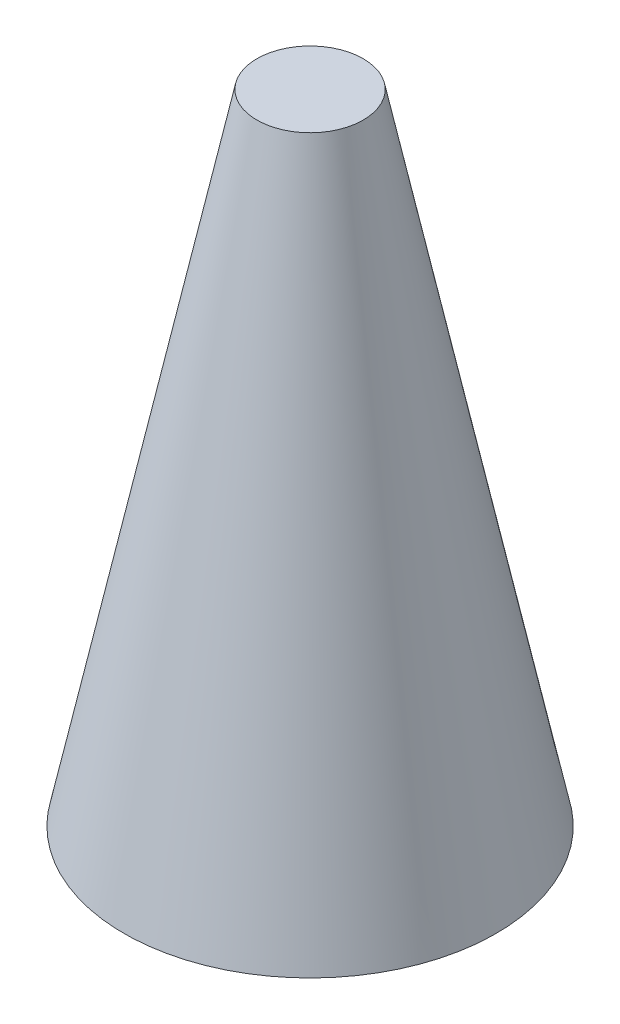
from build123d import *

# Parameters (mm, degrees)
SKETCH1_R          = 44.45
SKETCH2_R          = 12.7
SKETCH3_W          = 12.7
SKETCH3_H          = 2.27948718
CUT_EXTRUDE1_DEPTH = 0.635


with BuildPart() as part:
    # Sketch1 → Loft1 section 0
    with BuildSketch(Plane(origin=(0, 0, 0), x_dir=(1, 0, 0), z_dir=(0, 1, 0))):
        Circle(SKETCH1_R)
    # Sketch2 → Loft1 section 1
    with BuildSketch(Plane(origin=(0, 152.4, 0), x_dir=(1, 0, 0), z_dir=(0, 1, 0))):
        Circle(SKETCH2_R)
    loft()

    # Sketch3 → Cut-Extrude1 (cut, symmetric)
    # profile 1 of 8: a face of its own
    with BuildSketch(Plane.XY):
        Polygon((-12.7, 40.159604159), (-12.7, 42.273726755), (0, 47.402572909), (0, 44.967897428), (-2.605128205, 43.980798069), (-2.605128205, 38.447444704), (0, 37.460345345), (0, 35.028213935), align=None)
        Polygon((-9.293489583, 41.215393422), (-4.884615385, 39.312428678), (-4.884615385, 43.118358166), align=None, mode=Mode.SUBTRACT)
    # profile 2 of 8: a face of its own
    with BuildSketch(Plane.XY):
        Polygon((-12.7, 48.216675473), (-12.7, 50.651350954), (-3.678725962, 53.915393422), (-12.7, 57.187068102), (-12.7, 59.614111371), (0, 55.009343743), (0, 52.81381089), align=None)
    # profile 3 of 8: a face of its own
    with BuildSketch(Plane.XY):
        with Locations((-6.35, 62.463470345)):
            Rectangle(SKETCH3_W, SKETCH3_H)
    # profile 4 of 8: a face of its own
    with BuildSketch(Plane.XY):
        with BuildLine():
            add(Edge.make_bspline(
                [(-13.025641026, 72.502372589), (-13.019922875, 72.723176969), (-13.00863395, 73.159094828), (-12.914566289, 73.800184538), (-12.761211056, 74.417947016), (-12.548338685, 75.012321034), (-12.269051032, 75.580606207), (-11.936154491, 76.128341193), (-11.53517916, 76.648588623), (-11.080406068, 77.139551134), (-10.585538235, 77.593145033), (-10.052743409, 77.986084123), (-9.495390953, 78.322086503), (-8.911368625, 78.598511224), (-8.298685283, 78.810842923), (-7.659894011, 78.95919305), (-6.994821801, 79.054622362), (-6.541984355, 79.065589055), (-6.311838942, 79.071162653)],
                knots=[0, 0, 0, 0, 1.014235534, 2.002330665, 2.970116157, 3.9352621, 4.897279957, 5.875024536, 6.875755618, 7.909865842, 8.947091691, 9.955591861, 10.946663836, 11.933282567, 12.91916997, 13.920121047, 14.942943865, 16, 16, 16, 16], degree=3))
            add(Edge.make_bspline(
                [(-6.311838942, 79.071162653), (-6.084287447, 79.065225084), (-5.635889924, 79.053524915), (-4.976936454, 78.963107348), (-4.345025285, 78.812164139), (-3.738871989, 78.604011862), (-3.161533094, 78.332117676), (-2.6105987, 78.001863993), (-2.087958308, 77.609771832), (-1.595814177, 77.165235751), (-1.146050215, 76.678870136), (-0.75228548, 76.160850281), (-0.418701657, 75.617349717), (-0.143997915, 75.048794109), (0.063225645, 74.451086429), (0.218184545, 73.830973575), (0.30782395, 73.183411934), (0.319642272, 72.743481406), (0.325641026, 72.520181082)],
                knots=[0, 0, 0, 0, 1.051628416, 2.072267533, 3.067761847, 4.050852917, 5.029392597, 6.012272624, 7.015026456, 8.044749159, 9.073964344, 10.072810436, 11.047668484, 12.017263184, 12.98554948, 13.966731695, 14.967951888, 16, 16, 16, 16], degree=3))
            add(Edge.make_bspline(
                [(0.325641026, 72.520181082), (0.320322268, 72.28661812), (0.309871637, 71.827698824), (0.211329257, 71.155901664), (0.061088275, 70.51317926), (-0.156424517, 69.901292689), (-0.439052106, 69.320717622), (-0.780303352, 68.768850427), (-1.18676999, 68.249841636), (-1.646192299, 67.765421258), (-2.149031439, 67.326586345), (-2.680202567, 66.939215095), (-3.235688751, 66.612462207), (-3.815739357, 66.346310897), (-4.416752283, 66.136488115), (-5.042387137, 65.988481928), (-5.691143615, 65.901051154), (-6.131791977, 65.888872554), (-6.355088141, 65.882701114)],
                knots=[0, 0, 0, 0, 1.067953136, 2.098381936, 3.099641766, 4.083805132, 5.062469929, 6.048665414, 7.046702845, 8.073106546, 9.098695993, 10.09591865, 11.076726721, 12.041940862, 13.011263376, 13.984305721, 14.978557872, 16, 16, 16, 16], degree=3))
            add(Edge.make_bspline(
                [(-6.355088141, 65.882701114), (-6.505309894, 65.884638634), (-6.803851249, 65.88848914), (-7.246278119, 65.934850657), (-7.680054443, 66.001640845), (-8.103521218, 66.100260555), (-8.520167168, 66.220841461), (-8.926280439, 66.375024827), (-9.32461512, 66.55278815), (-9.710706686, 66.758316324), (-10.080107953, 66.990666806), (-10.435994612, 67.238793262), (-10.769052871, 67.512143635), (-11.082834981, 67.805131503), (-11.376139006, 68.118736218), (-11.648660059, 68.453589992), (-11.903517102, 68.807287645), (-12.137326798, 69.179861702), (-12.344000904, 69.568556452), (-12.529078651, 69.964794671), (-12.681011025, 70.370222964), (-12.80610225, 70.782465347), (-12.906628231, 71.200939202), (-12.973437772, 71.628970631), (-13.019780845, 72.06292166), (-13.023682996, 72.355541311), (-13.025641026, 72.502372589)],
                knots=[0, 0, 0, 0, 1.034634222, 2.056167603, 3.061938024, 4.056975325, 5.049831446, 6.048294015, 7.047371884, 8.053753139, 9.058980286, 10.052730068, 11.041053953, 12.024946181, 13.008838409, 13.997162294, 14.997691456, 16.01096975, 17.025258359, 18.029177048, 19.022170708, 20.005507574, 20.996177714, 21.984639769, 22.988728483, 24, 24, 24, 24], degree=3))
        make_face()
        with BuildLine():
            add(Edge.make_bspline(
                [(-10.746153846, 72.466755602), (-10.742166527, 72.318153822), (-10.734297154, 72.024873375), (-10.674343176, 71.59468437), (-10.578589859, 71.181687733), (-10.439892349, 70.788172867), (-10.26336562, 70.412434246), (-10.049626478, 70.053805801), (-9.79132788, 69.717253794), (-9.502336724, 69.39829063), (-9.180334163, 69.110159897), (-8.835253657, 68.855587305), (-8.467671483, 68.642551049), (-8.081002395, 68.46413185), (-7.6708984, 68.329821736), (-7.240571887, 68.234156669), (-6.789281382, 68.173699918), (-6.481637233, 68.166079269), (-6.324559295, 68.162188294)],
                knots=[0, 0, 0, 0, 1.033739768, 2.040188636, 3.016340934, 3.979330865, 4.937572243, 5.900995986, 6.878200029, 7.884839167, 8.891893314, 9.879764717, 10.863503415, 11.843163062, 12.837761627, 13.859916423, 14.907309254, 16, 16, 16, 16], degree=3))
            add(Edge.make_bspline(
                [(-6.324559295, 68.162188294), (-6.150486635, 68.16735897), (-5.809333063, 68.177492638), (-5.31158233, 68.248464697), (-4.841062105, 68.370973396), (-4.400108624, 68.544706786), (-3.986238415, 68.764896826), (-3.60178374, 69.034598762), (-3.244936614, 69.353769018), (-3.036539708, 69.59951887), (-2.930769231, 69.724247589)],
                knots=[0, 0, 0, 0, 1.078420897, 2.113526272, 3.107597235, 4.084297302, 5.043369457, 6.005430726, 6.9876695, 8, 8, 8, 8], degree=3))
            add(Edge.make_bspline(
                [(-2.930769231, 69.724247589), (-2.85263397, 69.826432799), (-2.698123851, 70.028500971), (-2.500087435, 70.351045765), (-2.330350472, 70.683203392), (-2.193205013, 71.027480396), (-2.085328701, 71.383149683), (-2.009784693, 71.750162478), (-1.962374295, 72.127998757), (-1.956707854, 72.383509356), (-1.953846154, 72.512548871)],
                knots=[0, 0, 0, 0, 1.023928204, 2.024787132, 3.009472467, 3.9914905, 4.972207045, 5.96565515, 6.972602802, 8, 8, 8, 8], degree=3))
            add(Edge.make_bspline(
                [(-1.953846154, 72.512548871), (-1.957873199, 72.658592448), (-1.965796538, 72.945937779), (-2.024927941, 73.368161292), (-2.125453519, 73.772466216), (-2.261908449, 74.162649338), (-2.444987196, 74.533302532), (-2.661276648, 74.890322206), (-2.921252371, 75.227484388), (-3.216332822, 75.544666), (-3.539466929, 75.835594999), (-3.884660788, 76.092249325), (-4.248702457, 76.308790041), (-4.631531715, 76.485848729), (-5.03272783, 76.624544245), (-5.453519807, 76.719241337), (-5.89199049, 76.780158945), (-6.19036471, 76.787788626), (-6.342367788, 76.791675473)],
                knots=[0, 0, 0, 0, 1.026460056, 2.019592442, 2.989754624, 3.951362471, 4.919177453, 5.890456226, 6.881277895, 7.906300149, 8.932084862, 9.933608786, 10.925308803, 11.904168404, 12.893913482, 13.903284022, 14.931853825, 16, 16, 16, 16], degree=3))
            add(Edge.make_bspline(
                [(-6.342367788, 76.791675473), (-6.493502337, 76.787667956), (-6.790987646, 76.77977977), (-7.22825203, 76.720314012), (-7.646694952, 76.621454212), (-8.047395052, 76.481733719), (-8.432455975, 76.307671058), (-8.798535724, 76.089019378), (-9.145317573, 75.830518063), (-9.470739862, 75.536892736), (-9.769802147, 75.217352183), (-10.02932874, 74.874279614), (-10.254850424, 74.517290996), (-10.431514685, 74.138190974), (-10.572262812, 73.744736731), (-10.675911731, 73.33452709), (-10.733875975, 72.906008439), (-10.742024742, 72.614478337), (-10.746153846, 72.466755602)],
                knots=[0, 0, 0, 0, 1.055040155, 2.076685641, 3.074845078, 4.052329834, 5.035358467, 6.020382375, 7.023447318, 8.050688466, 9.077178457, 10.074336316, 11.0503314, 12.019748348, 12.988025369, 13.964577102, 14.968620271, 16, 16, 16, 16], degree=3))
        make_face(mode=Mode.SUBTRACT)
    # profile 5 of 8: a face of its own
    with BuildSketch(Plane.XY):
        Polygon((-12.7, 81.350649832), (-12.7, 83.403714736), (-4.342728365, 89.166034448), (-12.7, 89.166034448), (-12.7, 91.445521627), (0, 91.445521627), (0, 89.3771923), (-8.331830929, 83.630137012), (0, 83.630137012), (0, 81.350649832), align=None)
    # profile 6 of 8: a face of its own
    with BuildSketch(Plane.XY):
        with Locations((-6.35, 95.190393422)):
            Rectangle(SKETCH3_W, SKETCH3_H)
    # profile 7 of 8: a face of its own
    with BuildSketch(Plane.XY):
        with BuildLine():
            Line((-10.496834936, 110.65834214), (-8.899158654, 108.986887813))
            add(Edge.make_bspline(
                [(-8.899158654, 108.986887813), (-9.045791405, 108.845114645), (-9.332211107, 108.568187233), (-9.710986026, 108.121727467), (-10.027970145, 107.658611732), (-10.289576457, 107.183461254), (-10.495483067, 106.695346095), (-10.641081641, 106.192629234), (-10.730836999, 105.676045227), (-10.741028031, 105.326327902), (-10.746153846, 105.15042948)],
                knots=[0, 0, 0, 0, 1.115315123, 2.178559852, 3.196385012, 4.180486591, 5.141138664, 6.08807191, 7.038351522, 8, 8, 8, 8], degree=3))
            add(Edge.make_bspline(
                [(-10.746153846, 105.15042948), (-10.742092303, 105.003538481), (-10.734077294, 104.713665278), (-10.675177782, 104.288095671), (-10.575394396, 103.880862004), (-10.436696215, 103.491641185), (-10.262028696, 103.118508865), (-10.042484221, 102.764939568), (-9.785390347, 102.429033177), (-9.491196962, 102.114714478), (-9.167390637, 101.830952684), (-8.826364533, 101.575279276), (-8.462086721, 101.363506768), (-8.07986949, 101.19063711), (-7.679574818, 101.054411844), (-7.261222743, 100.957727307), (-6.823868699, 100.901708222), (-6.526547888, 100.893356143), (-6.375440705, 100.889111371)],
                knots=[0, 0, 0, 0, 1.035268443, 2.04298821, 3.02163646, 3.985902049, 4.951223231, 5.920091634, 6.913651787, 7.92868536, 8.949353712, 9.945284791, 10.92850487, 11.913014323, 12.897904816, 13.904240668, 14.934873455, 16, 16, 16, 16], degree=3))
            add(Edge.make_bspline(
                [(-6.375440705, 100.889111371), (-6.269386761, 100.890353689), (-6.060352258, 100.892802324), (-5.751917409, 100.918875528), (-5.452051367, 100.96229608), (-5.161474825, 101.022781209), (-4.879808367, 101.10031813), (-4.606392442, 101.189886637), (-4.344486984, 101.304288485), (-4.089188155, 101.430129008), (-3.84664152, 101.57490458), (-3.616687392, 101.733434275), (-3.399274301, 101.904257084), (-3.19517529, 102.089654366), (-3.007328505, 102.291960677), (-2.830619137, 102.506290009), (-2.667834587, 102.734771559), (-2.521567087, 102.977496903), (-2.385230271, 103.227120904), (-2.272330271, 103.488786116), (-2.170838626, 103.755173275), (-2.09448667, 104.03095768), (-2.028076521, 104.311280875), (-1.987517795, 104.600044843), (-1.95669852, 104.894509065), (-1.954801035, 105.093526218), (-1.953846154, 105.193678678)],
                knots=[0, 0, 0, 0, 1.103738238, 2.175490744, 3.219137561, 4.256155604, 5.262629953, 6.259184223, 7.247888397, 8.234817694, 9.220364322, 10.185094651, 11.140491148, 12.096499151, 13.05201798, 14.011605636, 14.986460005, 15.968997565, 16.960259839, 17.944382265, 18.933125845, 19.924977513, 20.920749559, 21.929466621, 22.958034467, 24, 24, 24, 24], degree=3))
            add(Edge.make_bspline(
                [(-1.953846154, 105.193678678), (-1.958741281, 105.363560034), (-1.968358933, 105.697332722), (-2.044116752, 106.187075313), (-2.1674076, 106.654503587), (-2.317207159, 107.026627314), (-2.462459074, 107.318343313), (-2.593034057, 107.542284923), (-2.74356622, 107.771401221), (-2.914680636, 108.005343281), (-3.105629618, 108.245468944), (-3.320144243, 108.487804456), (-3.551290774, 108.738475996), (-3.716259055, 108.902691489), (-3.800841346, 108.986887813)],
                knots=[0, 0, 0, 0, 1.404693586, 2.759857621, 4.088769373, 5.395275838, 6.0697462, 6.783214465, 7.53810233, 8.336454657, 9.18000028, 10.074808326, 11.012918585, 12, 12, 12, 12], degree=3))
            Line((-3.800841346, 108.986887813), (-2.098858173, 110.60746073))
            add(Edge.make_bspline(
                [(-2.098858173, 110.60746073), (-1.988874352, 110.493543177), (-1.774209454, 110.271200475), (-1.469405329, 109.935802682), (-1.19550494, 109.600827), (-0.942566902, 109.274365744), (-0.717959914, 108.951071139), (-0.521459659, 108.630977468), (-0.348096362, 108.317708333), (-0.200793709, 108.004758599), (-0.075718457, 107.690180931), (0.031963125, 107.36651748), (0.12305787, 107.032778774), (0.196559365, 106.68692649), (0.255497641, 106.332186528), (0.295280637, 105.965238993), (0.322025422, 105.588410513), (0.324428662, 105.332801917), (0.325641026, 105.203854961)],
                knots=[0, 0, 0, 0, 1.244526981, 2.429050516, 3.560637417, 4.644440555, 5.67424972, 6.652764056, 7.595344123, 8.486817594, 9.369275933, 10.254498637, 11.166417451, 12.086725134, 13.032340136, 13.991389299, 14.986715468, 16, 16, 16, 16], degree=3))
            add(Edge.make_bspline(
                [(0.325641026, 105.203854961), (0.319603002, 104.966995374), (0.307788269, 104.503527003), (0.220249097, 103.824326189), (0.073491216, 103.179103648), (-0.134064907, 102.566289674), (-0.399208127, 101.986079127), (-0.724261264, 101.438620444), (-1.108360704, 100.924796006), (-1.547004428, 100.448756503), (-2.031449597, 100.018156116), (-2.551610806, 99.637555241), (-3.110044456, 99.322722182), (-3.698500699, 99.06130951), (-4.319664889, 98.856888238), (-4.974208936, 98.713010318), (-5.661500838, 98.624281854), (-6.13093705, 98.614574834), (-6.370352564, 98.609624191)],
                knots=[0, 0, 0, 0, 1.078019885, 2.10938526, 3.111377082, 4.085535484, 5.04941344, 6.010039228, 6.978205633, 7.964457913, 8.951525778, 9.924444315, 10.892603023, 11.863865945, 12.85144698, 13.863884204, 14.910567087, 16, 16, 16, 16], degree=3))
            add(Edge.make_bspline(
                [(-6.370352564, 98.609624191), (-6.526501068, 98.611695473), (-6.835949239, 98.615800247), (-7.292562241, 98.659750681), (-7.737120505, 98.719447), (-8.16582512, 98.8175103), (-8.583555871, 98.931513224), (-8.986616085, 99.078389079), (-9.376703602, 99.249029731), (-9.753325747, 99.443869677), (-10.112415501, 99.66702953), (-10.456262899, 99.909991299), (-10.780413764, 100.178647441), (-11.08620453, 100.470278814), (-11.377098802, 100.782190504), (-11.645942526, 101.119724407), (-11.899948143, 101.477124011), (-12.131540213, 101.856865086), (-12.342169216, 102.250294484), (-12.523378959, 102.655500484), (-12.678863557, 103.067259348), (-12.806874599, 103.486819588), (-12.902686732, 103.914923078), (-12.975142912, 104.348701252), (-13.01566168, 104.791794819), (-13.022293385, 105.089295566), (-13.025641026, 105.239471948)],
                knots=[0, 0, 0, 0, 1.071814294, 2.12407397, 3.147667899, 4.14936388, 5.141177959, 6.119239245, 7.091825145, 8.063277363, 9.028022524, 9.992609517, 10.952139039, 11.915934802, 12.892469547, 13.878248468, 14.87668965, 15.901326483, 16.93027266, 17.938917451, 18.9468897, 19.950817235, 20.948103127, 21.957084021, 22.968749718, 24, 24, 24, 24], degree=3))
            add(Edge.make_bspline(
                [(-13.025641026, 105.239471948), (-13.023720085, 105.367587079), (-13.019898177, 105.6224853), (-12.988094723, 106.002081989), (-12.938005907, 106.378601285), (-12.862960646, 106.750893419), (-12.772077381, 107.120632568), (-12.660133733, 107.486270732), (-12.523588718, 107.846799654), (-12.372541117, 108.205344832), (-12.200581265, 108.554755619), (-12.008105907, 108.891995396), (-11.80015038, 109.217899785), (-11.573137818, 109.530504124), (-11.33040274, 109.832010219), (-11.071953181, 110.122096368), (-10.793100932, 110.397978977), (-10.596089517, 110.571115671), (-10.496834936, 110.65834214)],
                knots=[0, 0, 0, 0, 0.996333415, 1.982307736, 2.96084097, 3.949129141, 4.93457382, 5.921430247, 6.92116383, 7.931890485, 8.946633814, 9.948019707, 10.950686436, 11.952094051, 12.951305284, 13.960287133, 14.972390273, 16, 16, 16, 16], degree=3))
        make_face()
    # profile 8 of 8: a face of its own
    with BuildSketch(Plane.XY):
        with BuildLine():
            Line((-11.003104968, 119.450649832), (-9.443589744, 117.746122589))
            add(Edge.make_bspline(
                [(-9.443589744, 117.746122589), (-9.546584482, 117.67310795), (-9.744320015, 117.532930027), (-10.009092556, 117.305716235), (-10.234963237, 117.079528429), (-10.420988475, 116.852271117), (-10.566038029, 116.621929978), (-10.668734715, 116.388904849), (-10.734019974, 116.154516815), (-10.742149559, 115.997044237), (-10.746153846, 115.919479961)],
                knots=[0, 0, 0, 0, 1.299362458, 2.494594718, 3.587462134, 4.587049575, 5.512617175, 6.380583204, 7.202344345, 8, 8, 8, 8], degree=3))
            add(Edge.make_bspline(
                [(-10.746153846, 115.919479961), (-10.743691987, 115.847094518), (-10.738938784, 115.707337245), (-10.689314792, 115.509030904), (-10.609125091, 115.330819154), (-10.498355813, 115.177449076), (-10.366065153, 115.054066184), (-10.225235288, 114.958128617), (-10.071684363, 114.902379109), (-9.966376452, 114.89521977), (-9.914242788, 114.891675473)],
                knots=[0, 0, 0, 0, 1.184157716, 2.286297433, 3.324836695, 4.370048774, 5.362957217, 6.276446515, 7.146738784, 8, 8, 8, 8], degree=3))
            add(Edge.make_bspline(
                [(-9.914242788, 114.891675473), (-9.861381805, 114.893919009), (-9.754927131, 114.898437177), (-9.598904547, 114.942076532), (-9.446452321, 115.0078535), (-9.353647397, 115.070706079), (-9.306209936, 115.102833326)],
                knots=[0, 0, 0, 0, 0.967525499, 1.948461899, 2.951351359, 4, 4, 4, 4], degree=3))
            add(Edge.make_bspline(
                [(-9.306209936, 115.102833326), (-9.269442534, 115.132153957), (-9.184319802, 115.20003616), (-9.047466749, 115.325658998), (-8.885709594, 115.489692442), (-8.695687378, 115.688060087), (-8.475595954, 115.920069939), (-8.229111769, 116.189318947), (-7.958632085, 116.497774354), (-7.767945278, 116.714123056), (-7.667828526, 116.827713134)],
                knots=[0, 0, 0, 0, 0.473854981, 1.097054127, 1.870604305, 2.795416232, 3.865517794, 5.093525133, 6.47400653, 8, 8, 8, 8], degree=3))
            add(Edge.make_bspline(
                [(-7.667828526, 116.827713134), (-7.575398237, 116.934568073), (-7.399984752, 117.137356548), (-7.150604048, 117.425518599), (-6.92724928, 117.680413909), (-6.728247901, 117.899724308), (-6.561795039, 118.090003307), (-6.417650289, 118.242835305), (-6.302119355, 118.364761194), (-6.23225864, 118.434000811), (-6.20244391, 118.463550473)],
                knots=[0, 0, 0, 0, 1.543627419, 2.929484142, 4.163674036, 5.24627963, 6.164986907, 6.925413438, 7.541394495, 8, 8, 8, 8], degree=3))
            add(Edge.make_bspline(
                [(-6.20244391, 118.463550473), (-6.081098935, 118.575660881), (-5.847831278, 118.791176455), (-5.486431291, 119.071442321), (-5.133942496, 119.30109563), (-4.784604367, 119.480831428), (-4.430351048, 119.615326913), (-4.063542534, 119.709552443), (-3.681393762, 119.76684264), (-3.421124935, 119.773117226), (-3.289483173, 119.776290858)],
                knots=[0, 0, 0, 0, 1.206593015, 2.319495511, 3.336910718, 4.276265636, 5.184178927, 6.099356736, 7.038670786, 8, 8, 8, 8], degree=3))
            add(Edge.make_bspline(
                [(-3.289483173, 119.776290858), (-3.161218902, 119.774017539), (-2.909559627, 119.769557202), (-2.541293755, 119.71492664), (-2.188847374, 119.637026647), (-1.856055402, 119.516579661), (-1.537455888, 119.369779346), (-1.238008902, 119.185744861), (-0.954694136, 118.969618203), (-0.692537267, 118.721916801), (-0.454762509, 118.447881266), (-0.242667928, 118.154129957), (-0.068948117, 117.836665265), (0.079828078, 117.501810079), (0.185699974, 117.143450874), (0.268992706, 116.768118959), (0.317790702, 116.371913168), (0.322986548, 116.101089024), (0.325641026, 115.962729159)],
                knots=[0, 0, 0, 0, 1.043169307, 2.046737005, 3.02462096, 3.976528701, 4.921503154, 5.875710796, 6.831116189, 7.817539083, 8.805892356, 9.780872653, 10.7604363, 11.74661763, 12.757588865, 13.796088471, 14.874055702, 16, 16, 16, 16], degree=3))
            add(Edge.make_bspline(
                [(0.325641026, 115.962729159), (0.323715498, 115.854109975), (0.31990185, 115.638981698), (0.288722479, 115.321925431), (0.238511738, 115.015732344), (0.166162557, 114.720930556), (0.075741762, 114.435213623), (-0.039688842, 114.161366657), (-0.172387507, 113.89742164), (-0.325205535, 113.643921138), (-0.502792215, 113.402463716), (-0.698195637, 113.166282623), (-0.920882088, 112.943157618), (-1.166528112, 112.728088309), (-1.436640268, 112.523850017), (-1.727119795, 112.323469731), (-2.043453802, 112.135933519), (-2.265360774, 112.020081091), (-2.378705929, 111.960906243)],
                knots=[0, 0, 0, 0, 1.016956594, 2.014157282, 2.980233409, 3.920138626, 4.854357287, 5.783465618, 6.699725051, 7.61900777, 8.551402113, 9.504102091, 10.486778735, 11.499758944, 12.559144124, 13.656050795, 14.802762778, 16, 16, 16, 16], degree=3))
            Line((-2.378705929, 111.960906243), (-3.582051282, 113.965633807))
            add(Edge.make_bspline(
                [(-3.582051282, 113.965633807), (-3.453389346, 114.039652348), (-3.206733419, 114.181552218), (-2.87531992, 114.422014814), (-2.591519116, 114.668356467), (-2.360347206, 114.926272376), (-2.178713124, 115.19262638), (-2.048904809, 115.468705031), (-1.968553608, 115.754702295), (-1.95874087, 115.94951064), (-1.953846154, 116.046683486)],
                knots=[0, 0, 0, 0, 1.283663364, 2.460892379, 3.537111102, 4.529833553, 5.449777664, 6.316464042, 7.160231139, 8, 8, 8, 8], degree=3))
            add(Edge.make_bspline(
                [(-1.953846154, 116.046683486), (-1.957843445, 116.145522183), (-1.965598771, 116.33728365), (-2.037232385, 116.610998605), (-2.149702414, 116.86195084), (-2.310181636, 117.078872099), (-2.495399049, 117.262547343), (-2.70146189, 117.398110217), (-2.92441691, 117.483271729), (-3.079296132, 117.492275365), (-3.157191506, 117.496803678)],
                knots=[0, 0, 0, 0, 1.13588714, 2.203786484, 3.234766741, 4.283437687, 5.291419208, 6.222934724, 7.106237994, 8, 8, 8, 8], degree=3))
            add(Edge.make_bspline(
                [(-3.157191506, 117.496803678), (-3.229660476, 117.492621967), (-3.37687425, 117.484127219), (-3.59575746, 117.421557527), (-3.814541127, 117.323742014), (-3.993993409, 117.208019365), (-4.14424394, 117.090257079), (-4.274429229, 116.977649772), (-4.418261182, 116.84052386), (-4.575920729, 116.679227035), (-4.748795786, 116.495890447), (-4.936869426, 116.290359661), (-5.138484943, 116.06028113), (-5.275823442, 115.89766117), (-5.347636218, 115.812628999)],
                knots=[0, 0, 0, 0, 0.916159276, 1.861089862, 2.860218735, 3.940849679, 4.552606315, 5.27541173, 6.11797699, 7.06649574, 8.129236253, 9.306560635, 10.591630461, 12, 12, 12, 12], degree=3))
            add(Edge.make_bspline(
                [(-5.347636218, 115.812628999), (-5.484407135, 115.650979321), (-5.746911923, 115.340724662), (-6.134624768, 114.902297619), (-6.496972545, 114.507228029), (-6.8384581, 114.158961099), (-7.152700093, 113.852953034), (-7.442488244, 113.591610388), (-7.709863512, 113.37633374), (-8.028674574, 113.152878054), (-8.41371335, 112.937991064), (-8.876666221, 112.751919022), (-9.340026436, 112.632333516), (-9.651528648, 112.6188331), (-9.804847756, 112.612188294)],
                knots=[0, 0, 0, 0, 1.345561566, 2.582539916, 3.71901348, 4.751744315, 5.681651107, 6.506005906, 7.230637833, 7.861516384, 8.978504332, 10.023243174, 11.027054763, 12, 12, 12, 12], degree=3))
            add(Edge.make_bspline(
                [(-9.804847756, 112.612188294), (-9.913578295, 112.614943138), (-10.127789135, 112.620370478), (-10.442755804, 112.668781487), (-10.746668906, 112.741137561), (-11.038435073, 112.846204787), (-11.31763127, 112.982622108), (-11.585843116, 113.148098007), (-11.840255008, 113.346506831), (-12.083369493, 113.567258036), (-12.303264692, 113.813409921), (-12.497244307, 114.075354666), (-12.661966643, 114.351943437), (-12.794194126, 114.644241907), (-12.899156597, 114.949862633), (-12.972687016, 115.269577733), (-13.016650212, 115.602786582), (-13.02260675, 115.829455129), (-13.025641026, 115.944920666)],
                knots=[0, 0, 0, 0, 1.010608097, 1.99100651, 2.956992389, 3.912457524, 4.868345712, 5.842283282, 6.837666818, 7.864758285, 8.892394644, 9.901925088, 10.892014243, 11.880216914, 12.880338321, 13.892361018, 14.926363314, 16, 16, 16, 16], degree=3))
            add(Edge.make_bspline(
                [(-13.025641026, 115.944920666), (-13.020167209, 116.094555387), (-13.009262785, 116.392643665), (-12.9239896, 116.833373668), (-12.789899517, 117.263868814), (-12.628100206, 117.610742669), (-12.471443426, 117.88680809), (-12.326980806, 118.098191131), (-12.16212128, 118.314541947), (-11.972218376, 118.532511692), (-11.763501003, 118.757391538), (-11.53115806, 118.985859125), (-11.27757974, 119.220348155), (-11.096199349, 119.372537764), (-11.003104968, 119.450649832)],
                knots=[0, 0, 0, 0, 1.282949271, 2.555771389, 3.837399776, 5.142782039, 5.830402679, 6.558840402, 7.337330299, 8.162747002, 9.037840561, 9.968992266, 10.957575255, 12, 12, 12, 12], degree=3))
        make_face()
    extrude(amount=CUT_EXTRUDE1_DEPTH, both=True, mode=Mode.SUBTRACT)


solid = part.part
